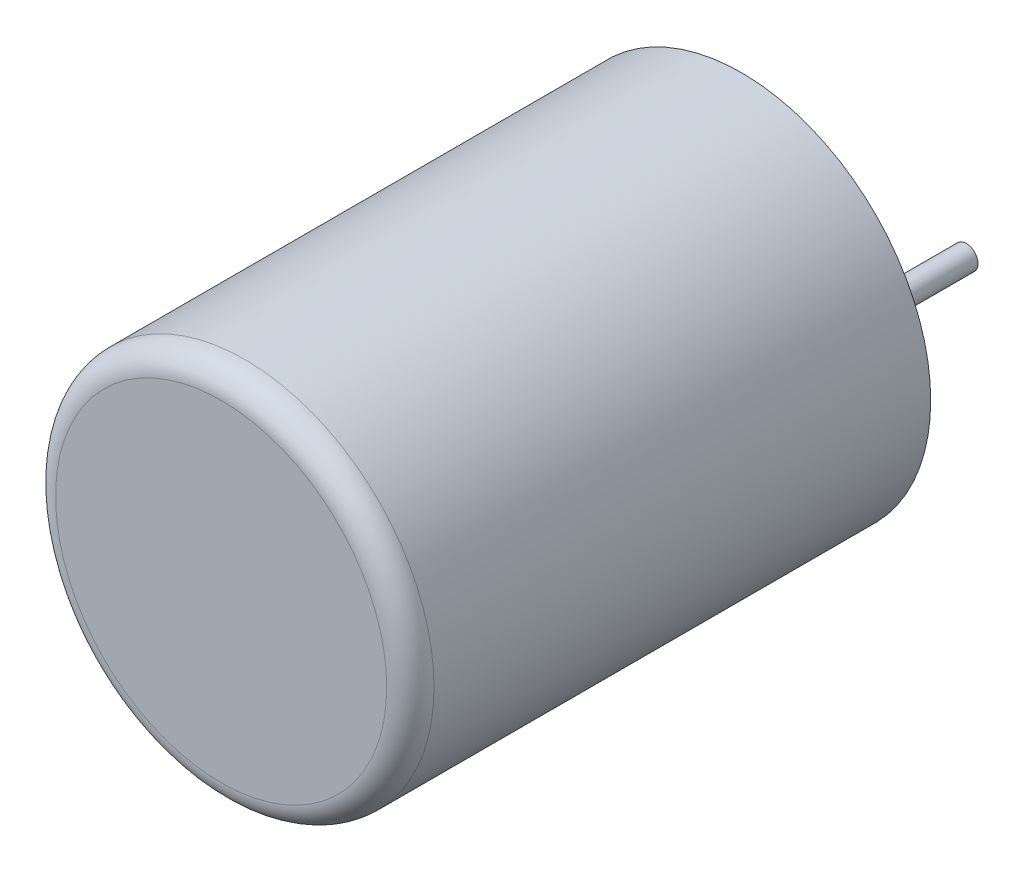
from build123d import *

# Parameters (mm, degrees)
SKETCH_1_R      = 4
EXTRUDE_1_DEPTH = 11
SKETCH_2_R      = 0.25
EXTRUDE_2_DEPTH = 3
FILLET_1_R      = 0.5


with BuildPart() as part:
    # Эскиз1 → Вытянуть1 (new body)
    with BuildSketch(Plane.XY):
        Circle(SKETCH_1_R)
    extrude(amount=EXTRUDE_1_DEPTH)

    # Эскиз2 → Вытянуть2 (add)
    with BuildSketch(Plane(origin=(0, 0, 0), x_dir=(-1, 0, 0), z_dir=(0, 0, -1))):
        with Locations(Location((-1.75, 0, 0), (0, 0, 180))):
            Circle(SKETCH_2_R)
        with Locations(Location((1.75, 0, 0), (0, 0, 180))):
            Circle(SKETCH_2_R)
    extrude(amount=EXTRUDE_2_DEPTH)

    # Скругление1
    fillet_1_edges = [part.edges().sort_by_distance(p)[0] for p in [
        (-4, 0, 11),
    ]]
    fillet(fillet_1_edges, radius=FILLET_1_R)


solid = part.part
